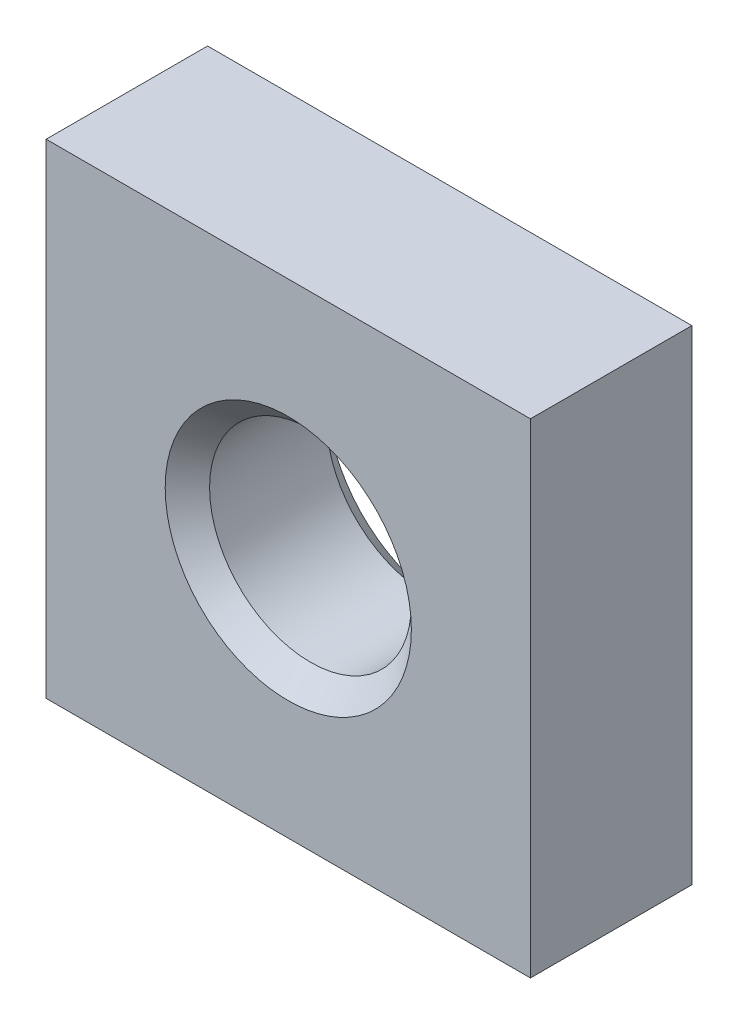
from build123d import *

# Parameters (mm, degrees)
SKETCH_1_W      = 6
SKETCH_1_H      = 6
EXTRUDE_1_DEPTH = 2


with BuildPart() as part:
    # 草图1 → 凸台-拉伸1 (new body)
    with BuildSketch(Plane.XY):
        Rectangle(SKETCH_1_W, SKETCH_1_H)
    extrude(amount=EXTRUDE_1_DEPTH)

    # 草图3 → M3 螺纹孔1 (revolve, cut)
    with BuildSketch(Plane(origin=(0, 0, 2), x_dir=(0, -1, 0), z_dir=(1, 0, 0))):
        Polygon((0, 0), (0, 2), (1.525, 2), (1.25, 1.725), (1.25, 0.275), (1.525, 0), align=None)
    revolve(axis=Axis((0, 0, 8.35), (0, 0, -1)), mode=Mode.SUBTRACT)


solid = part.part
